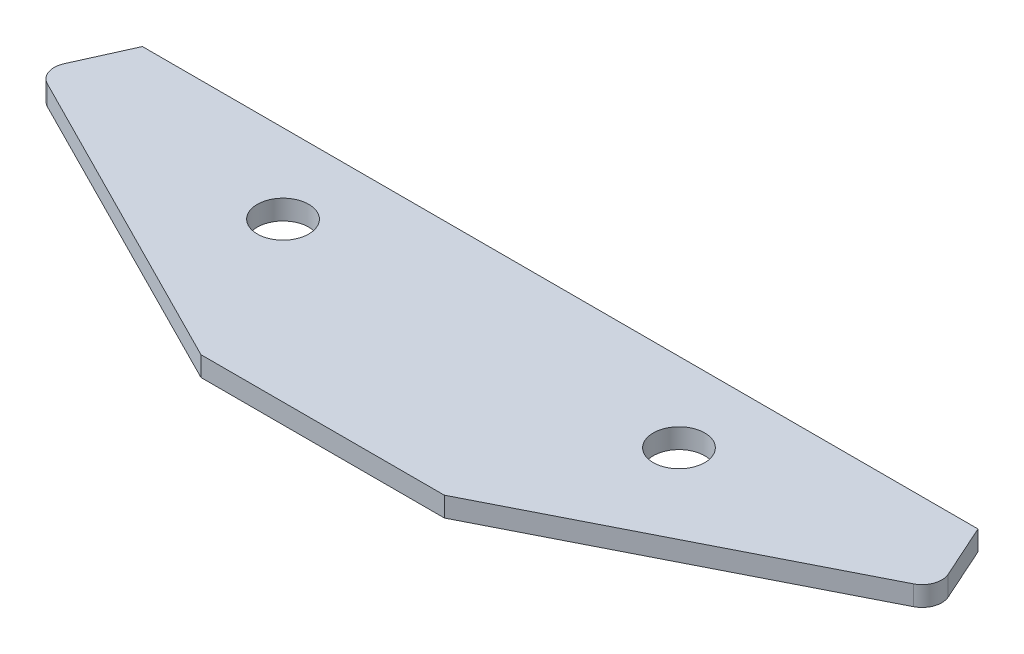
from build123d import *

# Parameters (mm, degrees)
BOSS_EXTRUDE1_DEPTH = 10
SKETCH2_R           = 13
CUT_EXTRUDE1_DEPTH  = 10
CUT_EXTRUDE2_DEPTH  = 10


with BuildPart() as part:
    # Sketch1 → Boss-Extrude1 (new body)
    with BuildSketch(Plane(origin=(0, 0, 0), x_dir=(1, 0, 0), z_dir=(0, 1, 0))):
        with BuildLine():
            Line((248.032931618, 52.593341059), (260.305567907, 25.2785247))
            ThreePointArc((260.305567907, 25.2785247), (260.612237386, 17.847313664), (255.703480887, 12.259733394))
            Line((255.703480887, 12.259733394), (41.520626689, -96.255259938))
            ThreePointArc((41.520626689, -96.255259938), (37.001121909, -97.334829649), (32.481617129, -96.255259938))
            Line((32.481617129, -96.255259938), (-181.70123707, 12.259733394))
            ThreePointArc((-181.70123707, 12.259733394), (-186.609993569, 17.847313664), (-186.30332409, 25.2785247))
            Line((-186.30332409, 25.2785247), (-174.0306878, 52.593341059))
            Line((-174.0306878, 52.593341059), (248.032931618, 52.593341059))
        make_face()
    extrude(amount=BOSS_EXTRUDE1_DEPTH)

    # Sketch2 → Cut-Extrude1 (cut)
    with BuildSketch(Plane(origin=(0, 10, 0), x_dir=(1, 0, 0), z_dir=(0, 1, 0))):
        with Locations(Location((137.001121909, 12.593341059, 0), (0, 0, 270))):
            Circle(SKETCH2_R)
        with Locations(Location((-62.998878091, 12.593341059, 0), (0, 0, 270))):
            Circle(SKETCH2_R)
    extrude(amount=-CUT_EXTRUDE1_DEPTH, mode=Mode.SUBTRACT)

    # Sketch3 → Cut-Extrude2 (cut)
    with BuildSketch(Plane(origin=(0, 10, 0), x_dir=(1, 0, 0), z_dir=(0, 1, 0))):
        Polygon((37.001121909, -67.406658941), (125.459060888, -67.406658941), (125.459060888, -160.473444946), (-80.94279673, -160.473444946), (-80.94279673, -67.406658941), align=None)
    extrude(amount=-CUT_EXTRUDE2_DEPTH, mode=Mode.SUBTRACT)


solid = part.part
